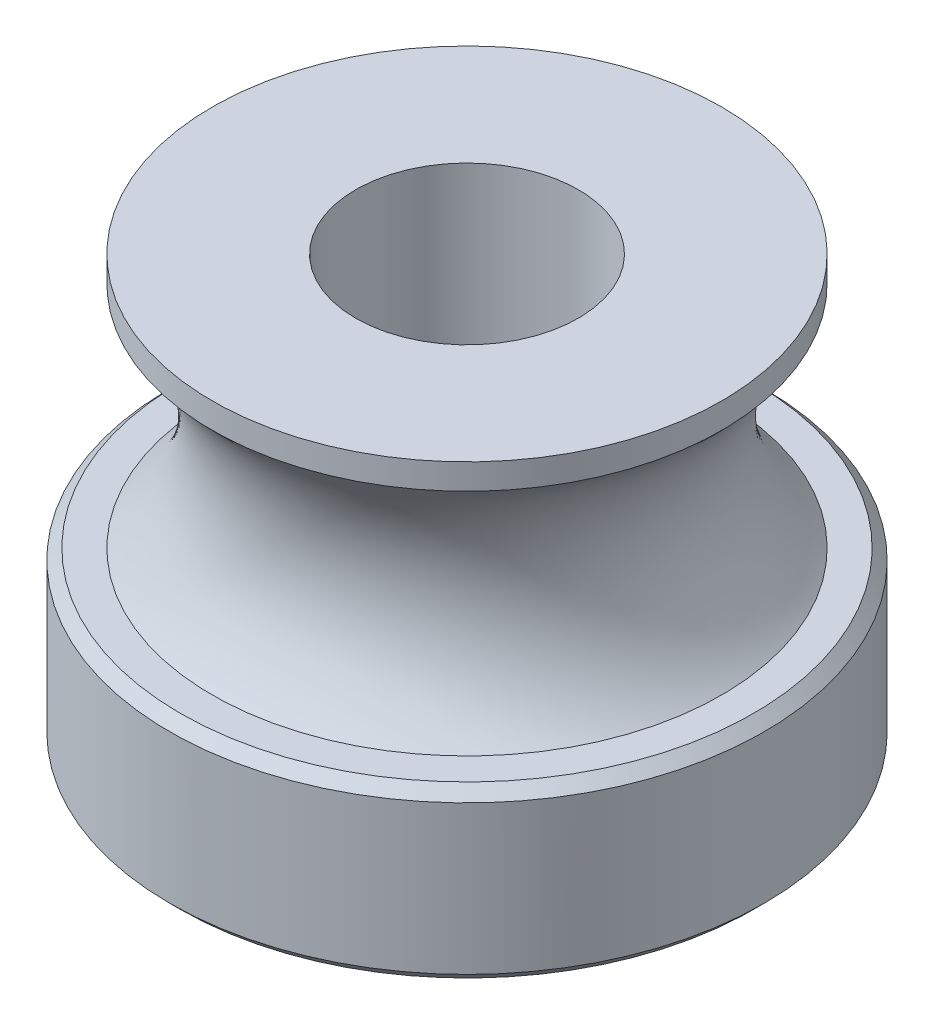
from build123d import *

# Parameters (mm, degrees)
SKETCH3_R          = 2.0828
CUT_EXTRUDE1_DEPTH = 12.169052528
CHAMFER1_SIZE      = 0.1984375


with BuildPart() as part:
    # Sketch1 → Revolve1 (revolve)
    with BuildSketch(Plane.XY):
        with BuildLine():
            Line((0, 7.9375), (-4.7625, 7.9375))
            Line((-4.7625, 7.9375), (-4.7625, 7.46125))
            ThreePointArc((-4.7625, 7.46125), (-3.81, 5.318125), (-4.7625, 3.175))
            Line((-4.7625, 3.175), (-5.55625, 3.175))
            Line((-5.55625, 3.175), (-5.55625, 0))
            Line((-5.55625, 0), (0, 0))
            Line((0, 0), (0, 7.9375))
        make_face()
    revolve(axis=Axis((0, 0, 0), (0, 1, 0)))

    # Sketch3 → Cut-Extrude1 (cut, through all)
    with BuildSketch(Plane(origin=(0, 0, 0), x_dir=(1, 0, 0), z_dir=(0, 1, 0))):
        Circle(SKETCH3_R)
    extrude(amount=CUT_EXTRUDE1_DEPTH, mode=Mode.SUBTRACT)

    # Chamfer1
    chamfer1_edges = [part.edges().sort_by_distance(p)[0] for p in [
        (5.55625, 3.175, 0),
        (5.55625, 0, 0),
    ]]
    chamfer(chamfer1_edges, length=CHAMFER1_SIZE)


solid = part.part
